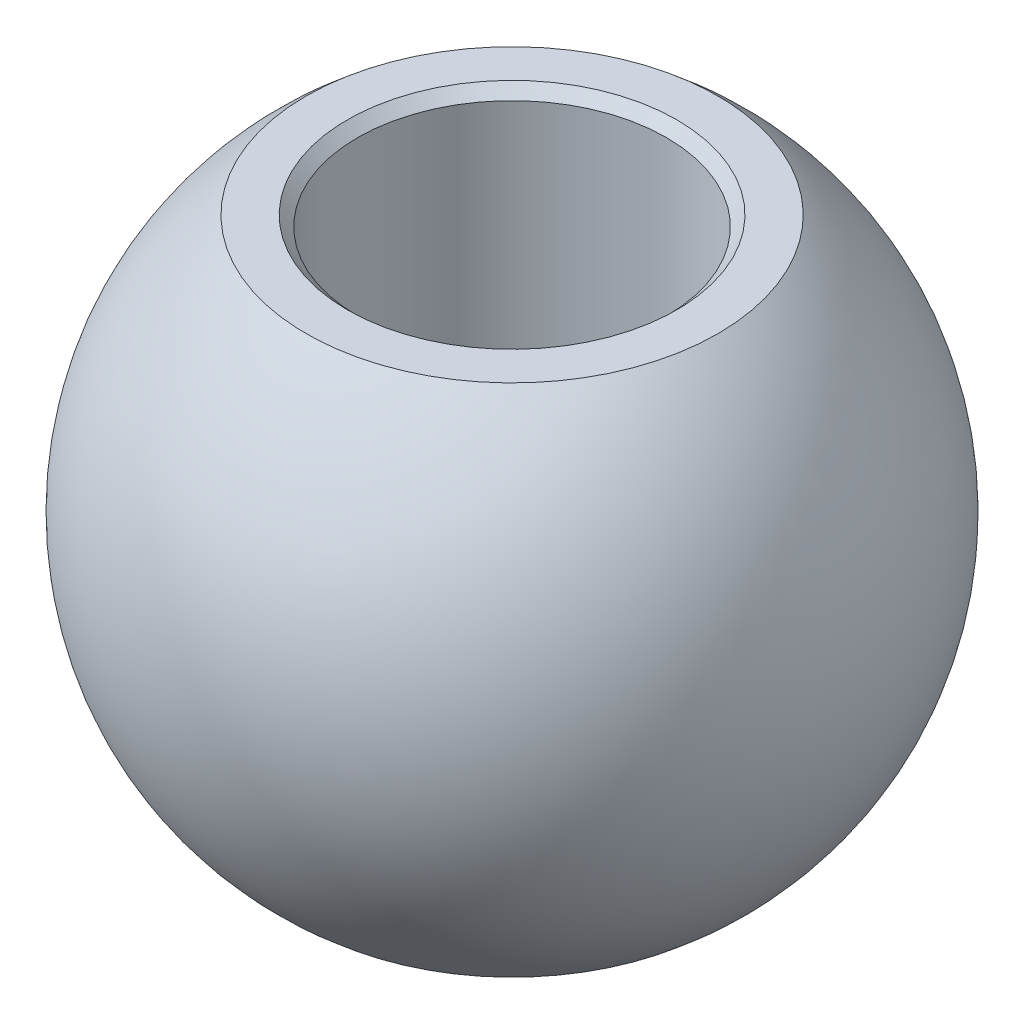
from build123d import *

# Parameters (mm, degrees)
SKETCH2_R          = 1.5
CUT_EXTRUDE1_DEPTH = 7.745368782
CHAMFER1_SIZE      = 0.1


with BuildPart() as part:
    # Sketch1 → Revolve2 (revolve)
    with BuildSketch(Plane.XY):
        with BuildLine():
            Line((0, 5), (2, 5))
            ThreePointArc((2, 5), (3.201562119, 2.5), (2, 0))
            Line((2, 0), (0, 0))
            Line((0, 0), (0, 5))
        make_face()
    revolve(axis=Axis((0, 0, 0), (0, -1, 0)))

    # Sketch2 → Cut-Extrude1 (cut, through all)
    with BuildSketch(Plane(origin=(0, 5, 0), x_dir=(1, 0, 0), z_dir=(0, 1, 0))):
        with Locations(Location((0, 0, 0), (0, 0, 270))):
            Circle(SKETCH2_R)
    extrude(amount=-CUT_EXTRUDE1_DEPTH, mode=Mode.SUBTRACT)

    # Chamfer1
    chamfer1_edges = [part.edges().sort_by_distance(p)[0] for p in [
        (0, 0, -1.5),
        (0, 5, -1.5),
    ]]
    chamfer(chamfer1_edges, length=CHAMFER1_SIZE)


solid = part.part
